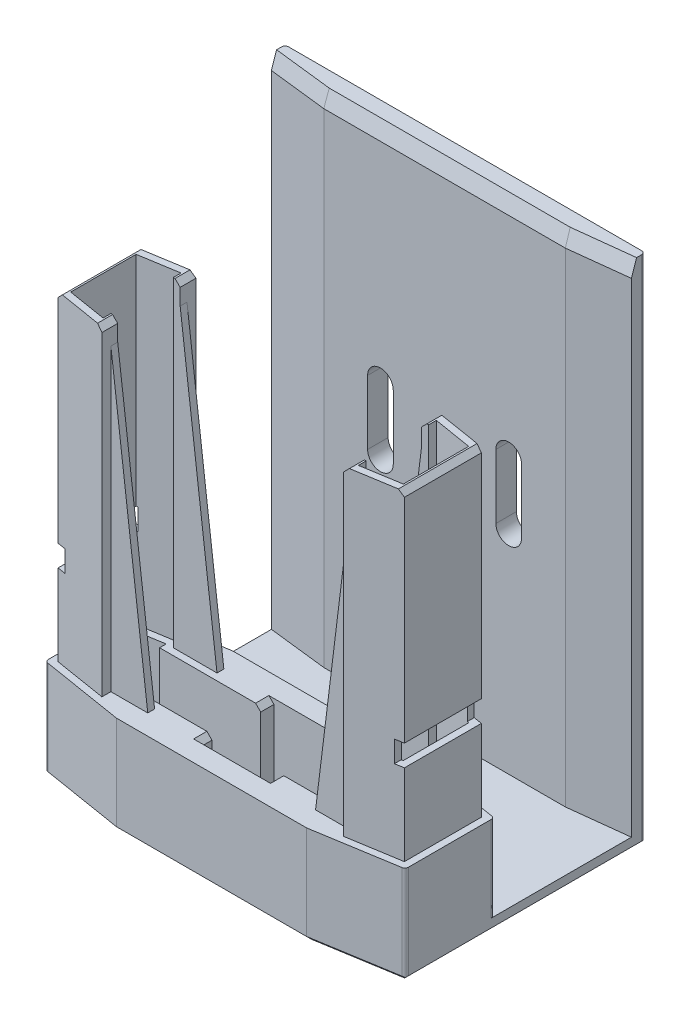
from build123d import *
from OCP.BRepFilletAPI import BRepFilletAPI_MakeChamfer

# Parameters (mm, degrees)
BOSS_EXTRUDE1_DEPTH     = 23.2
BOSS_EXTRUDE2_START     = 23.2
BOSS_EXTRUDE2_DEPTH     = 75
CUT_EXTRUDE1_DEPTH      = 108.706127959
CUT_EXTRUDE1_DEPTH_BACK = 108.706127959
SKETCH2_W               = 2
SKETCH2_H               = 5
CUT_EXTRUDE2_DEPTH      = 108.706127959
CUT_EXTRUDE2_DEPTH_BACK = 108.706127959
CUT_EXTRUDE3_DEPTH      = 108.706127959
CUT_EXTRUDE3_DEPTH_BACK = 108.706127959
BOSS_EXTRUDE3_DEPTH     = 3.2
SKETCH5_W               = 84.2
SKETCH5_H               = 3.2
BOSS_EXTRUDE4_DEPTH     = 120
BOSS_EXTRUDE5_DEPTH     = 120
CUT_EXTRUDE4_DEPTH      = 136.132897549
CUT_EXTRUDE4_DEPTH_BACK = 136.132897549
CHAMFER1_SIZE           = 3.6
CHAMFER1_SIZE2          = 1.2
CHAMFER2_SIZE           = 1.2
FILLET1_R               = 0.8


with BuildPart() as part:
    # Sketch1 → Boss-Extrude1 (new body)
    with BuildSketch(Plane(origin=(0, 0, 0), x_dir=(1, 0, 0), z_dir=(0, 1, 0))):
        Polygon((-22.25475327, 13.6), (22.25475327, 13.6), (42.1, 10.359959718), (42.1, -10.359959718), (22.25475327, -13.6), (-22.25475327, -13.6), (-42.1, -10.359959718), (-42.1, 10.359959718), align=None)
    extrude(amount=BOSS_EXTRUDE1_DEPTH)

    # Sketch1<3> → Boss-Extrude2 (add)
    with BuildSketch(Plane(origin=(0, 0, 0), x_dir=(1, 0, 0), z_dir=(0, 1, 0)).offset(BOSS_EXTRUDE2_START)):
        Polygon((40.5, -9), (28.25, -11), (28.25, -8.9), (11, -8.9), (11, -12), (-11, -12), (-11, -8.9), (-28.25, -8.9), (-28.25, -11), (-40.5, -9), (-40.5, 9), (-28.25, 11), (-28.25, 8.9), (-11, 8.9), (-11, 12), (11, 12), (11, 8.9), (28.25, 8.9), (28.25, 11), (40.5, 9), align=None)
        Polygon((-38.9, -7.640040282), (-29.85, -9.117591303), (-29.85, -7.3), (-9.4, -7.3), (-9.4, -10.4), (9.4, -10.4), (9.4, -7.3), (29.85, -7.3), (29.85, -9.117591303), (38.9, -7.640040282), (38.9, 7.640040282), (29.85, 9.117591303), (29.85, 7.3), (9.4, 7.3), (9.4, 10.4), (-9.4, 10.4), (-9.4, 7.3), (-29.85, 7.3), (-29.85, 9.117591303), (-38.9, 7.640040282), align=None, mode=Mode.SUBTRACT)
    extrude(amount=BOSS_EXTRUDE2_DEPTH)

    # Sketch2 → Cut-Extrude1 (cut, two sides: drawn at the far end of the back side and taken through both)
    with BuildSketch(Plane.XY.offset(-CUT_EXTRUDE1_DEPTH_BACK)):
        with Locations((-39.5, 44.7)):
            Rectangle(SKETCH2_W, SKETCH2_H)
        with Locations((39.5, 44.7)):
            Rectangle(SKETCH2_W, SKETCH2_H)
    extrude(amount=CUT_EXTRUDE1_DEPTH + CUT_EXTRUDE1_DEPTH_BACK, mode=Mode.SUBTRACT)

    # Sketch3 → Cut-Extrude2 (cut, two sides: drawn at the far end of the back side and taken through both)
    with BuildSketch(Plane.XY.offset(-CUT_EXTRUDE2_DEPTH_BACK)):
        Polygon((-28.25, 93.2), (-19.625, 23.2), (19.625, 23.2), (28.25, 93.2), (28.25, 98.2), (-28.25, 98.2), align=None)
    extrude(amount=CUT_EXTRUDE2_DEPTH + CUT_EXTRUDE2_DEPTH_BACK, mode=Mode.SUBTRACT)

    # Sketch1<4> → Cut-Extrude3 (cut, two sides: drawn at the far end of the back side and taken through both)
    with BuildSketch(Plane(origin=(0, 0, 0), x_dir=(1, 0, 0), z_dir=(0, 1, 0)).offset(-CUT_EXTRUDE3_DEPTH_BACK)):
        Polygon((-31.45, -5.7), (-7.8, -5.7), (-7.8, -8.8), (7.8, -8.8), (7.8, -5.7), (31.45, -5.7), (31.45, -7.235182606), (37.3, -6.280080565), (37.3, 6.280080565), (31.45, 7.235182606), (31.45, 5.7), (7.8, 5.7), (7.8, 8.8), (-7.8, 8.8), (-7.8, 5.7), (-31.45, 5.7), (-31.45, 7.235182606), (-37.3, 6.280080565), (-37.3, -6.280080565), (-31.45, -7.235182606), align=None)
    extrude(amount=CUT_EXTRUDE3_DEPTH + CUT_EXTRUDE3_DEPTH_BACK, mode=Mode.SUBTRACT)

    # Sketch4 → Boss-Extrude3 (add)
    with BuildSketch(Plane(origin=(0, 0, 0), x_dir=(1, 0, 0), z_dir=(0, 1, 0))):
        Polygon((42.1, 10.359959718), (22.25475327, 13.6), (-22.25475327, 13.6), (-42.1, 10.359959718), (-42.1, 42.5), (42.1, 42.5), align=None)
    extrude(amount=BOSS_EXTRUDE3_DEPTH)

    # Sketch5 → Boss-Extrude4 (add)
    with BuildSketch(Plane(origin=(0, 0, 0), x_dir=(1, 0, 0), z_dir=(0, 1, 0))):
        with Locations((0, 44.1)):
            Rectangle(SKETCH5_W, SKETCH5_H)
    extrude(amount=BOSS_EXTRUDE4_DEPTH)

    # Sketch6 → Boss-Extrude5 (add)
    with BuildSketch(Plane(origin=(0, 0, 0), x_dir=(1, 0, 0), z_dir=(0, 1, 0))):
        Polygon((-42.1, 42.5), (42.1, 42.5), (28.25, 40.9), (-28.25, 40.9), align=None)
    extrude(amount=BOSS_EXTRUDE5_DEPTH)

    # Sketch7 → Cut-Extrude4 (cut, two sides: drawn at the far end of the back side and taken through both)
    with BuildSketch(Plane(origin=(0, 0, 0), x_dir=(-1, 0, 0), z_dir=(0, 0, -1)).offset(-CUT_EXTRUDE4_DEPTH_BACK)):
        with BuildLine():
            Line((-12, 67.5), (-12, 52.5))
            ThreePointArc((-12, 52.5), (-15, 49.5), (-18, 52.5))
            Line((-18, 52.5), (-18, 67.5))
            ThreePointArc((-18, 67.5), (-15, 70.5), (-12, 67.5))
        make_face()
        with BuildLine():
            Line((12, 67.5), (12, 52.5))
            ThreePointArc((12, 52.5), (15, 49.5), (18, 52.5))
            Line((18, 52.5), (18, 67.5))
            ThreePointArc((18, 67.5), (15, 70.5), (12, 67.5))
        make_face()
    extrude(amount=CUT_EXTRUDE4_DEPTH + CUT_EXTRUDE4_DEPTH_BACK, mode=Mode.SUBTRACT)

    # Chamfer1: one chamfer whose edges measure the first distance from different faces: ONE call of the kernel's chamfer builder (chamfer() names one face for all edges)
    chamfer1_edges_1 = [part.edges().sort_by_distance(p)[0] for p in [
        (35.175, 120, -41.7),
    ]]
    chamfer1_side_1 = [part.faces().sort_by_distance(p)[0] for p in [
        (35.175, 61.6, -41.7),
    ]]
    chamfer1_edges_2 = [part.edges().sort_by_distance(p)[0] for p in [
        (0, 120, -40.9),
    ]]
    chamfer1_side_2 = [part.faces().sort_by_distance(p)[0] for p in [
        (0, 61.659484301, -40.9),
    ]]
    chamfer1_edges_3 = [part.edges().sort_by_distance(p)[0] for p in [
        (-35.175, 120, -41.7),
    ]]
    chamfer1_side_3 = [part.faces().sort_by_distance(p)[0] for p in [
        (-35.175, 61.6, -41.7),
    ]]
    chamfer1 = BRepFilletAPI_MakeChamfer(part.part.solid().wrapped)
    for e in chamfer1_edges_1:
        chamfer1.Add(CHAMFER1_SIZE, CHAMFER1_SIZE2, e.wrapped, chamfer1_side_1[0].wrapped)  # the first distance lies on this face
    for e in chamfer1_edges_2:
        chamfer1.Add(CHAMFER1_SIZE, CHAMFER1_SIZE2, e.wrapped, chamfer1_side_2[0].wrapped)  # the first distance lies on this face
    for e in chamfer1_edges_3:
        chamfer1.Add(CHAMFER1_SIZE, CHAMFER1_SIZE2, e.wrapped, chamfer1_side_3[0].wrapped)  # the first distance lies on this face
    add(Compound.cast(chamfer1.Shape()), mode=Mode.REPLACE)

    # Chamfer2
    chamfer2_edges = [part.edges().sort_by_distance(p)[0] for p in [
        (-42.1, 0, -17.670020141),
        (-7.8, 23.2, 7.25),
        (7.8, 23.2, 7.25),
        (7.8, 23.2, -7.25),
        (-7.8, 23.2, -7.25),
        (-7.8, 0, -7.25),
        (-7.8, 0, 7.25),
        (40.5, 98.2, 0),
        (28.25, 98.2, -9.15),
        (0, 0, -45.7),
        (-28.25, 98.2, 9.15),
        (28.25, 98.2, 9.15),
        (-28.25, 98.2, -9.15),
        (-40.5, 98.2, 0),
        (-32.177376635, 0, 11.979979859),
        (0, 0, 13.6),
        (32.177376635, 0, 11.979979859),
        (42.1, 0, -17.670020141),
    ]]
    chamfer(chamfer2_edges, length=CHAMFER2_SIZE)

    # Fillet1
    fillet1_edges = [part.edges().sort_by_distance(p)[0] for p in [
        (-42.1, 12.2, 10.359959718),
        (42.1, 12.2, 10.359959718),
        (42.1, 13.2, -10.359959718),
        (-42.1, 13.2, -10.359959718),
        (-42.1, 60.6, -45.7),
        (42.1, 60.6, -45.7),
    ]]
    fillet(fillet1_edges, radius=FILLET1_R)


solid = part.part
